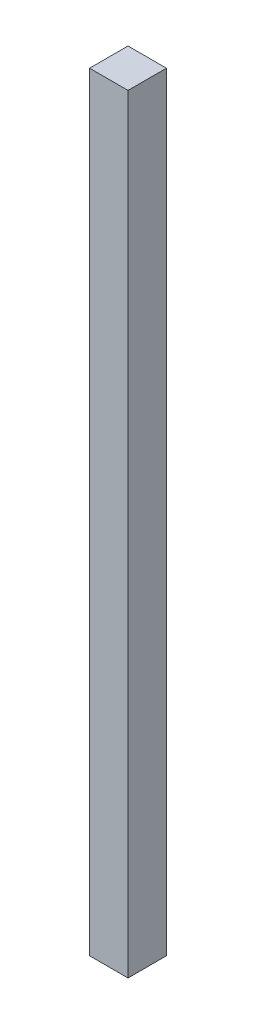
from build123d import *

# Parameters (mm, degrees)
SKETCH1_W           = 1.25
SKETCH1_H           = 1.25
BOSS_EXTRUDE1_DEPTH = 25


with BuildPart() as part:
    # Sketch1 → Boss-Extrude1 (new body)
    with BuildSketch(Plane(origin=(0, 0, 0), x_dir=(1, 0, 0), z_dir=(0, 1, 0))):
        Rectangle(SKETCH1_W, SKETCH1_H)
    extrude(amount=BOSS_EXTRUDE1_DEPTH)


solid = part.part
